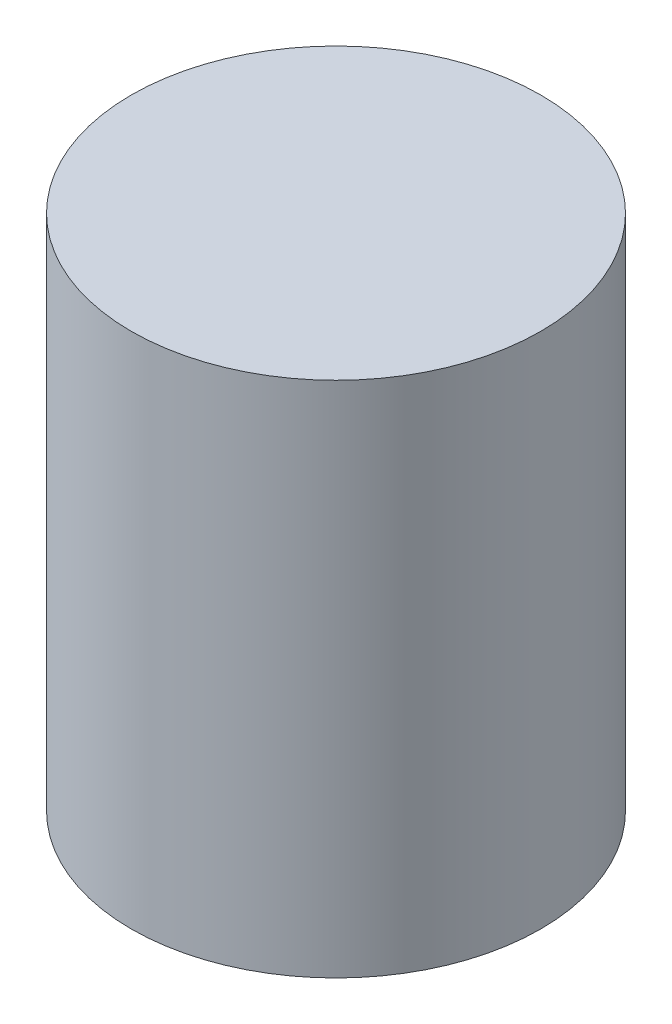
from build123d import *

# Parameters (mm, degrees)
SKETCH1_R           = 25
SKETCH1_R_2         = 23
EXTRUDE_THIN1_DEPTH = 30
SKETCH2_R           = 140
BOSS_EXTRUDE1_DEPTH = 2
SKETCH3_R           = 140
SKETCH3_R_2         = 138
BOSS_EXTRUDE2_DEPTH = 350
SKETCH4_R           = 140
BOSS_EXTRUDE3_DEPTH = 2


with BuildPart() as part:
    # Sketch1 → Extrude-Thin1 (new body)
    with BuildSketch(Plane(origin=(0, 0, 0), x_dir=(1, 0, 0), z_dir=(0, 1, 0))):
        Circle(SKETCH1_R)
        Circle(SKETCH1_R_2, mode=Mode.SUBTRACT)
    extrude(amount=EXTRUDE_THIN1_DEPTH)

    # Sketch2 → Boss-Extrude1 (add)
    with BuildSketch(Plane(origin=(0, 30, 0), x_dir=(1, 0, 0), z_dir=(0, 1, 0))):
        with Locations(Location((0, 0, 0), (0, 0, 270))):
            Circle(SKETCH2_R)
    extrude(amount=BOSS_EXTRUDE1_DEPTH)

    # Sketch3 → Boss-Extrude2 (add)
    with BuildSketch(Plane(origin=(0, 32, 0), x_dir=(1, 0, 0), z_dir=(0, 1, 0))):
        with Locations(Location((0, 0, 0), (0, 0, 270))):
            Circle(SKETCH3_R)
        with Locations(Location((0, 0, 0), (0, 0, 270))):
            Circle(SKETCH3_R_2, mode=Mode.SUBTRACT)
    extrude(amount=BOSS_EXTRUDE2_DEPTH)

    # Sketch4 → Boss-Extrude3 (add)
    with BuildSketch(Plane(origin=(0, 382, 0), x_dir=(1, 0, 0), z_dir=(0, 1, 0))):
        with Locations(Location((0, 0, 0), (0, 0, 270))):
            Circle(SKETCH4_R)
    extrude(amount=BOSS_EXTRUDE3_DEPTH)


solid = part.part
